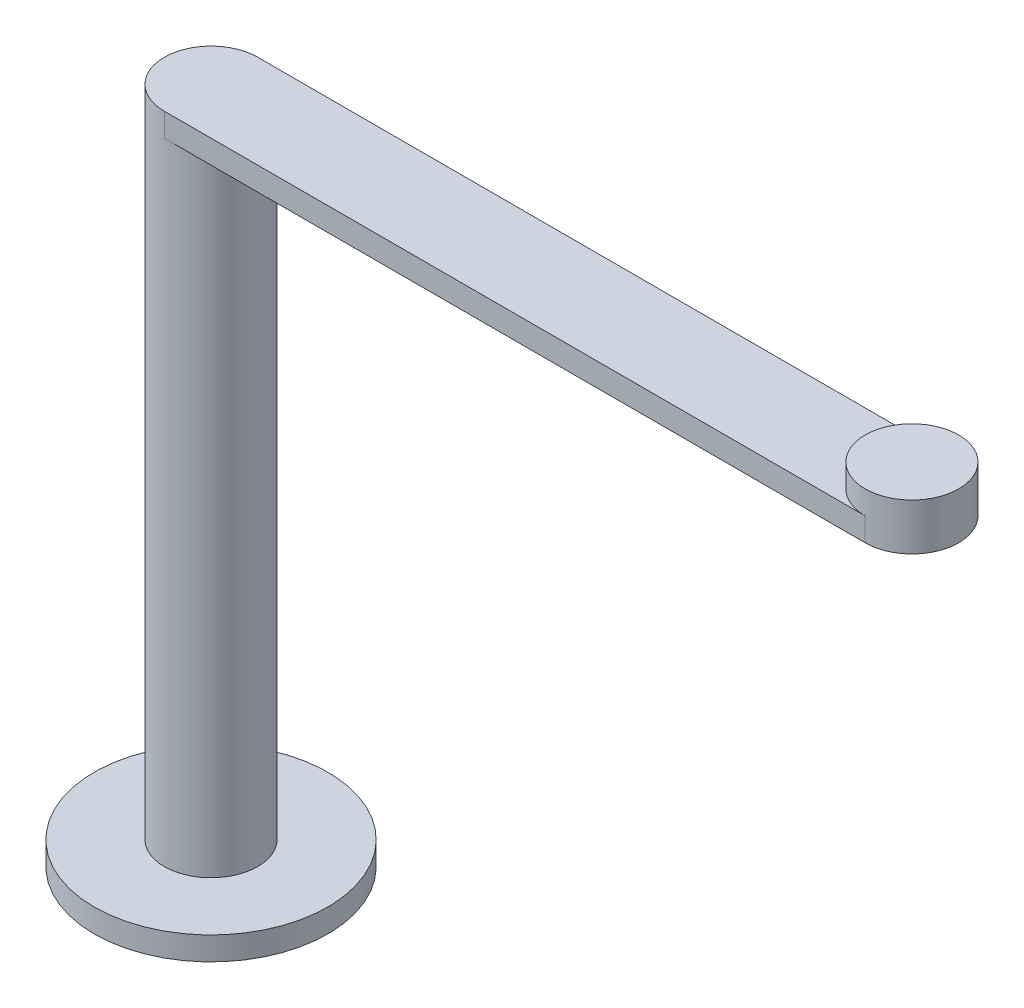
from build123d import *

# Parameters (mm, degrees)
SKETCH1_R                = 50
BOSS_EXTRUDE1_DEPTH      = 10
SKETCH2_R                = 20
BOSS_EXTRUDE2_DEPTH      = 280
BOSS_EXTRUDE3_START      = -10
BOSS_EXTRUDE3_DEPTH      = 10
BOSS_EXTRUDE4_DEPTH      = 10
BOSS_EXTRUDE4_DEPTH_BACK = 10
SKETCH5_R                = 20


with BuildPart() as part:
    # Sketch1 → Boss-Extrude1 (new body)
    with BuildSketch(Plane(origin=(0, 0, 0), x_dir=(1, 0, 0), z_dir=(0, 1, 0))):
        with Locations(Location((0, 0, 0), (0, 0, 270))):
            Circle(SKETCH1_R)
    extrude(amount=BOSS_EXTRUDE1_DEPTH)

    # Sketch2 → Boss-Extrude2 (add)
    with BuildSketch(Plane(origin=(0, 10, 0), x_dir=(1, 0, 0), z_dir=(0, 1, 0))):
        with Locations(Location((0, 0, 0), (0, 0, 270))):
            Circle(SKETCH2_R)
    extrude(amount=BOSS_EXTRUDE2_DEPTH)

    # Sketch4 → Boss-Extrude3 (add)
    with BuildSketch(Plane(origin=(0, 290, 0), x_dir=(1, 0, 0), z_dir=(0, 1, 0)).offset(BOSS_EXTRUDE3_START)):
        with BuildLine():
            Line((0, 20), (300, 20))
            Line((300, 20), (300, -20))
            Line((300, -20), (0, -20))
            ThreePointArc((0, -20), (-20, 0), (0, 20))
        make_face()
    extrude(amount=BOSS_EXTRUDE3_DEPTH)

    # Sketch5 → Boss-Extrude4 (add, two sides: drawn at the far end of the back side and taken through both)
    with BuildSketch(Plane(origin=(0, 290, 0), x_dir=(1, 0, 0), z_dir=(0, 1, 0)).offset(-BOSS_EXTRUDE4_DEPTH_BACK)):
        with Locations(Location((300, 0, 0), (0, 0, 270))):
            Circle(SKETCH5_R)
    extrude(amount=BOSS_EXTRUDE4_DEPTH + BOSS_EXTRUDE4_DEPTH_BACK)


solid = part.part
